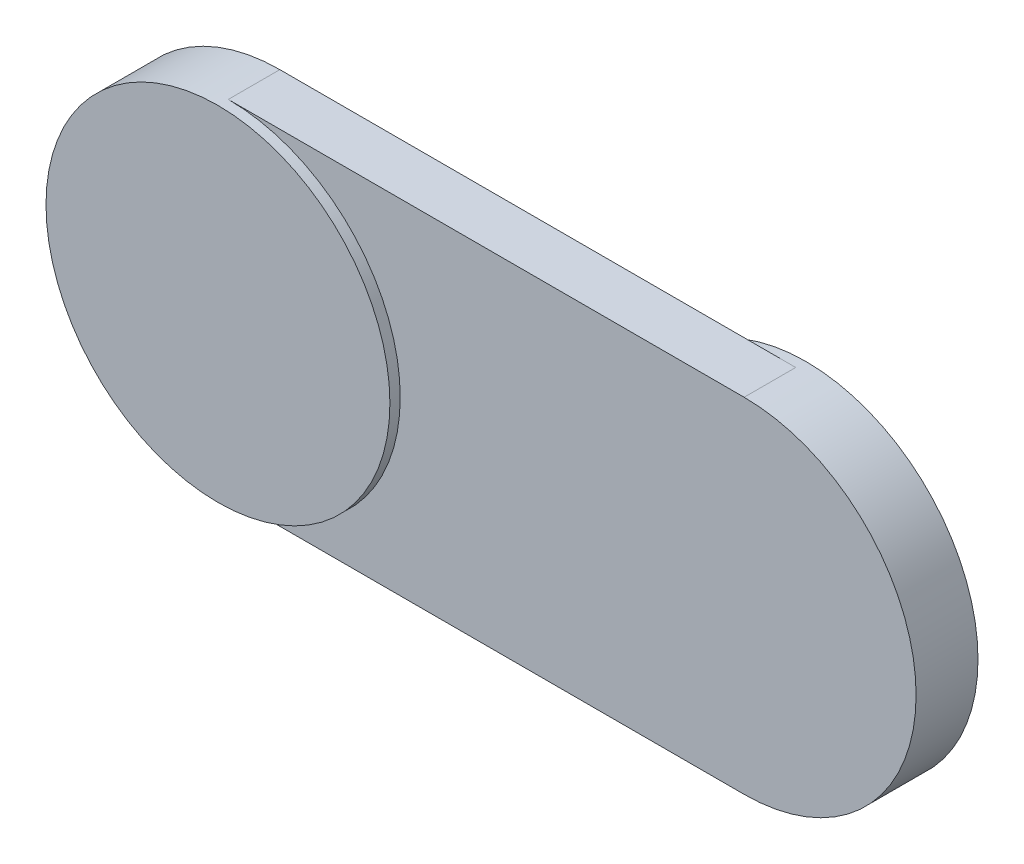
from build123d import *

# Parameters (mm, degrees)
SKETCH_1_W      = 150
SKETCH_1_H      = 100
EXTRUDE_1_DEPTH = 15
EXTRUDE_4_DEPTH = 15
SKETCH_1_14_R   = 50
EXTRUDE_6_DEPTH = 18
EXTRUDE_START   = -3
SKETCH_1_16_R   = 50
EXTRUDE_7_DEPTH = 3
SKETCH_1_17_R   = 5
EXTRUDE_8_DEPTH = 25


with BuildPart() as part:
    # 草图1 → 凸台-拉伸1 (new body)
    with BuildSketch(Plane.XY):
        with Locations((-75, 50)):
            Rectangle(SKETCH_1_W, SKETCH_1_H)
    extrude(amount=EXTRUDE_1_DEPTH)

    # 草图1<10> → 凸台-拉伸4 (add)
    with BuildSketch(Plane.XY):
        with BuildLine():
            ThreePointArc((-150, 100), (-200, 50), (-150, 0))
            Line((-150, 0), (-150, 100))
        make_face()
        with BuildLine():
            Line((0, 100), (0, 0))
            ThreePointArc((0, 0), (50, 50), (0, 100))
        make_face()
    extrude(amount=EXTRUDE_4_DEPTH)

    # 草图1<14> → 凸台-拉伸6 (add)
    with BuildSketch(Plane.XY):
        with Locations((-150, 50)):
            Circle(SKETCH_1_14_R)
    extrude(amount=EXTRUDE_6_DEPTH)

    # 草图1<16> → 凸台-拉伸7 (add)
    with BuildSketch(Plane.XY.offset(EXTRUDE_START)):
        with Locations((0, 50)):
            Circle(SKETCH_1_16_R)
    extrude(amount=EXTRUDE_7_DEPTH)

    # 草图1<17> → 凸台-拉伸8 (add)
    with BuildSketch(Plane.XY):
        with Locations((-75, 50)):
            Circle(SKETCH_1_17_R)
    extrude(amount=-EXTRUDE_8_DEPTH)


solid = part.part
